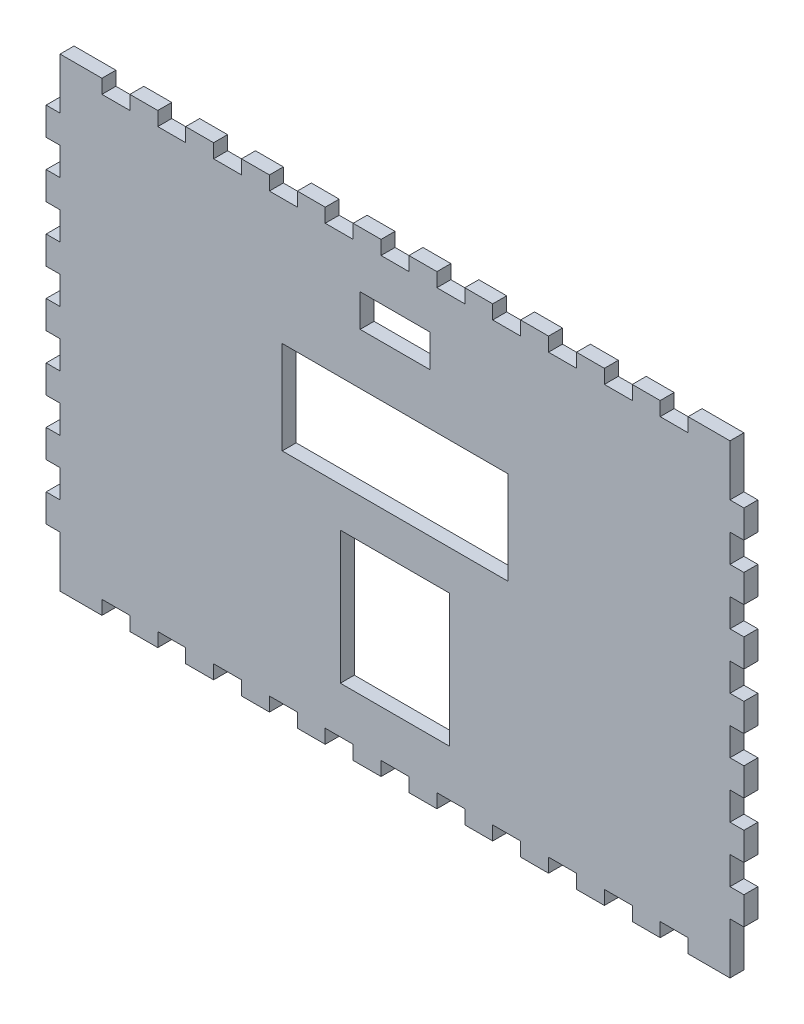
from build123d import *

# Parameters (mm, degrees)
BOSS_EXTRUDE1_DEPTH = 6
SKETCH2_W           = 30
SKETCH2_H           = 14
SKETCH2_W_2         = 97
SKETCH2_H_2         = 40
SKETCH2_W_3         = 47
SKETCH2_H_3         = 57
CUT_EXTRUDE1_DEPTH  = 6


with BuildPart() as part:
    # Model → Boss-Extrude1 (new body)
    with BuildSketch(Plane.XY):
        Polygon((209, 406), (209, 384), (203, 384), (203, 372), (209, 372), (209, 360), (203, 360), (203, 348), (209, 348), (209, 336), (203, 336), (203, 324), (209, 324), (209, 312), (203, 312), (203, 300), (209, 300), (209, 288), (203, 288), (203, 276), (209, 276), (209, 264), (203, 264), (203, 252), (209, 252), (209, 240), (203, 240), (203, 228), (209, 228), (209, 216), (209, 206), (227, 206), (227, 212), (239, 212), (239, 206), (251, 206), (251, 212), (263, 212), (263, 206), (275, 206), (275, 212), (287, 212), (287, 206), (299, 206), (299, 212), (311, 212), (311, 206), (323, 206), (323, 212), (335, 212), (335, 206), (347, 206), (347, 212), (359, 212), (359, 206), (371, 206), (371, 212), (383, 212), (383, 206), (395, 206), (395, 212), (407, 212), (407, 206), (419, 206), (419, 212), (431, 212), (431, 206), (443, 206), (443, 212), (455, 212), (455, 206), (467, 206), (467, 212), (479, 212), (479, 206), (491, 206), (497, 206), (497, 228), (503, 228), (503, 240), (497, 240), (497, 252), (503, 252), (503, 264), (497, 264), (497, 276), (503, 276), (503, 288), (497, 288), (497, 300), (503, 300), (503, 312), (497, 312), (497, 324), (503, 324), (503, 336), (497, 336), (497, 348), (503, 348), (503, 360), (497, 360), (497, 372), (503, 372), (503, 384), (497, 384), (497, 396), (497, 406), (479, 406), (479, 400), (467, 400), (467, 406), (455, 406), (455, 400), (443, 400), (443, 406), (431, 406), (431, 400), (419, 400), (419, 406), (407, 406), (407, 400), (395, 400), (395, 406), (383, 406), (383, 400), (371, 400), (371, 406), (359, 406), (359, 400), (347, 400), (347, 406), (335, 406), (335, 400), (323, 400), (323, 406), (311, 406), (311, 400), (299, 400), (299, 406), (287, 406), (287, 400), (275, 400), (275, 406), (263, 406), (263, 400), (251, 400), (251, 406), (239, 406), (239, 400), (227, 400), (227, 406), (215, 406), align=None)
    extrude(amount=BOSS_EXTRUDE1_DEPTH)

    # Sketch2 → Cut-Extrude1 (cut)
    with BuildSketch(Plane.XY.offset(6)):
        with Locations((353, 375)):
            Rectangle(SKETCH2_W, SKETCH2_H)
        with Locations((353, 326)):
            Rectangle(SKETCH2_W_2, SKETCH2_H_2)
        with Locations((353, 260.5)):
            Rectangle(SKETCH2_W_3, SKETCH2_H_3)
    extrude(amount=-CUT_EXTRUDE1_DEPTH, mode=Mode.SUBTRACT)


solid = part.part
